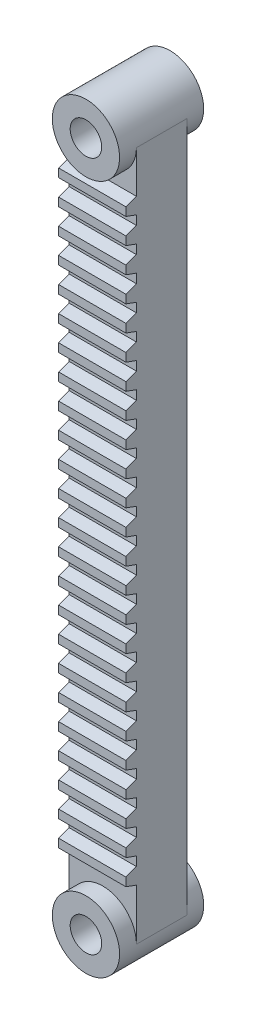
from build123d import *

# Parameters (mm, degrees)
SKETCH1_R             = 8
SKETCH1_R_2           = 3.75
BOSS_EXTRUDE1_DEPTH   = 10
BOSS_EXTRUDE1_2_DEPTH = 10
BOSS_EXTRUDE2_DEPTH   = 6
BOSS_EXTRUDE3_DEPTH   = 16
LPATTERN1_COUNT       = 24
LPATTERN1_PITCH       = 6


with BuildPart() as part:
    # Sketch1 → Boss-Extrude1 (new, symmetric)
    with BuildSketch(Plane(origin=(0, 0, 0), x_dir=(0, 1, 0), z_dir=(0, 0, 1))):
        with Locations(Location((-82, 0, 0), (0, 0, 270))):
            Circle(SKETCH1_R)
        with Locations(Location((-82, 0, 0), (0, 0, 270))):
            Circle(SKETCH1_R_2, mode=Mode.SUBTRACT)
    extrude(amount=BOSS_EXTRUDE1_DEPTH, both=True)



with BuildPart() as body_2:
    # Sketch1 → Boss-Extrude1 2 (new, symmetric)
    with BuildSketch(Plane(origin=(0, 0, 0), x_dir=(0, 1, 0), z_dir=(0, 0, 1))):
        with Locations(Location((82, 0, 0), (0, 0, 90))):
            Circle(SKETCH1_R)
        with Locations(Location((82, 0, 0), (0, 0, 90))):
            Circle(SKETCH1_R_2, mode=Mode.SUBTRACT)
    extrude(amount=BOSS_EXTRUDE1_2_DEPTH, both=True)


with BuildPart() as part_1:
    add(part.part)

    add(body_2.part)  # Boss-Extrude2 merges body 2
    # Sketch2 → Boss-Extrude2 (add, symmetric)
    with BuildSketch(Plane(origin=(0, 0, 0), x_dir=(0, 1, 0), z_dir=(0, 0, 1))):
        with BuildLine():
            Line((82, 8), (-82, 8))
            ThreePointArc((-82, 8), (-76.343145751, 5.656854249), (-74, 0))
            ThreePointArc((-74, 0), (-76.343145751, -5.656854249), (-82, -8))
            Line((-82, -8), (82, -8))
            ThreePointArc((82, -8), (74, 0), (82, 8))
        make_face()
    extrude(amount=BOSS_EXTRUDE2_DEPTH, both=True)

    # Sketch3 → Boss-Extrude3 (add)
    with BuildSketch(Plane.YZ.offset(8)):
        Polygon((72, 6), (71.090074414, 8.5), (69.090074414, 8.5), (68.180148829, 6), align=None)
    boss_extrude3 = extrude(amount=-BOSS_EXTRUDE3_DEPTH)

    # LPattern1: Boss-Extrude3 ×24
    with Locations(*[(0, -i * LPATTERN1_PITCH, 0) for i in range(1, LPATTERN1_COUNT)]):
        add(boss_extrude3)


solid = part_1.part
